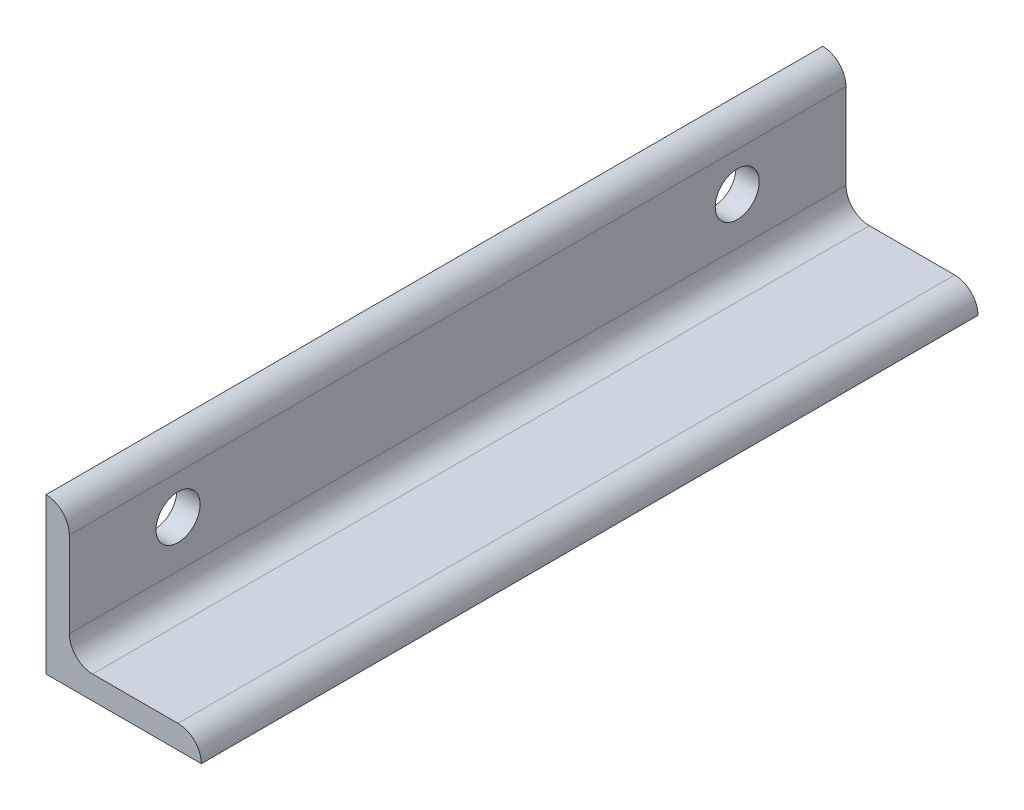
from build123d import *

# Parameters (mm, degrees)
BOSS_EXTRUDE1_DEPTH  = 79.375
M8_CLEARANCE_HOLE1_D = 9


with BuildPart() as part:
    # Sketch1 → Boss-Extrude1 (new, symmetric)
    with BuildSketch(Plane.XY):
        with BuildLine():
            Line((0, 0), (0, 31.75))
            ThreePointArc((0, 31.75), (3.367596045, 30.355096045), (4.7625, 26.9875))
            Line((4.7625, 26.9875), (4.7625, 9.525))
            ThreePointArc((4.7625, 9.525), (6.157403955, 6.157403955), (9.525, 4.7625))
            Line((9.525, 4.7625), (26.9875, 4.7625))
            ThreePointArc((26.9875, 4.7625), (30.355096045, 3.367596045), (31.75, 0))
            Line((31.75, 0), (0, 0))
        make_face()
    extrude(amount=BOSS_EXTRUDE1_DEPTH, both=True)

    # M8 Clearance Hole1 (through all)
    with Locations(Plane.ZY):
        with Locations((-57.15, 19.05), (57.15, 19.05)):
            Hole(M8_CLEARANCE_HOLE1_D / 2)


solid = part.part
